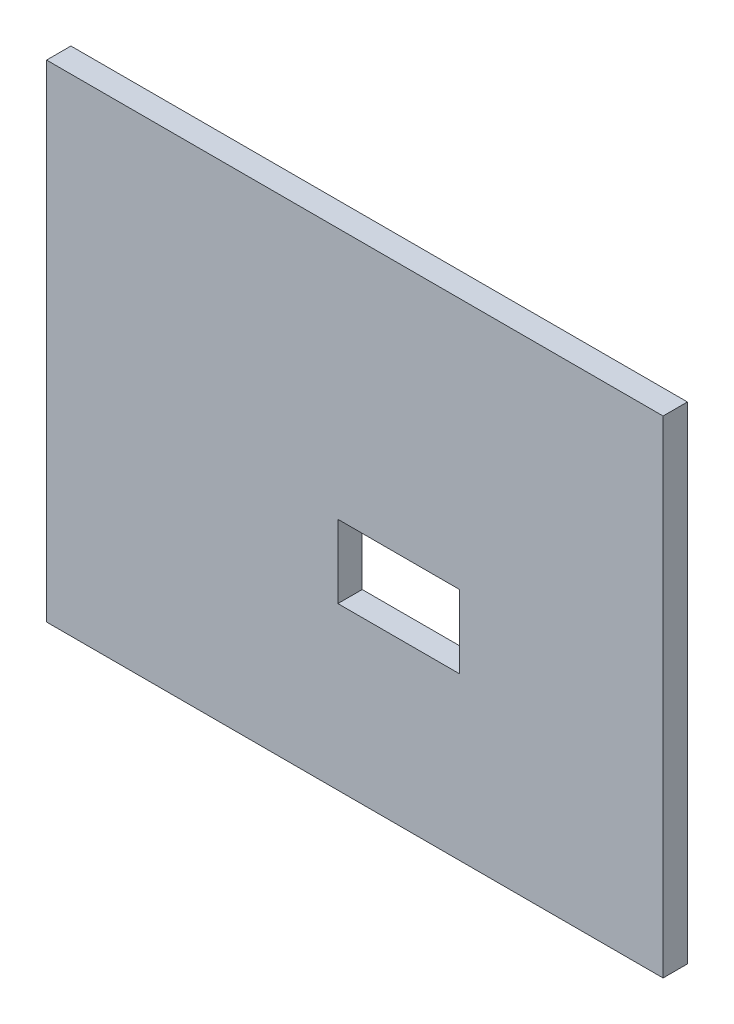
from build123d import *

# Parameters (mm, degrees)
SKETCH1_W           = 76
SKETCH1_H           = 60
BOSS_EXTRUDE1_DEPTH = 3
SKETCH2_W           = 15
SKETCH2_H           = 9
CUT_EXTRUDE1_DEPTH  = 3


with BuildPart() as part:
    # Sketch1 → Boss-Extrude1 (new body)
    with BuildSketch(Plane.XY):
        Rectangle(SKETCH1_W, SKETCH1_H)
    extrude(amount=BOSS_EXTRUDE1_DEPTH)

    # Sketch2 → Cut-Extrude1 (cut)
    with BuildSketch(Plane.XY.offset(3)):
        with Locations((5.410634621, -5.571264483)):
            Rectangle(SKETCH2_W, SKETCH2_H)
    extrude(amount=-CUT_EXTRUDE1_DEPTH, mode=Mode.SUBTRACT)


solid = part.part
